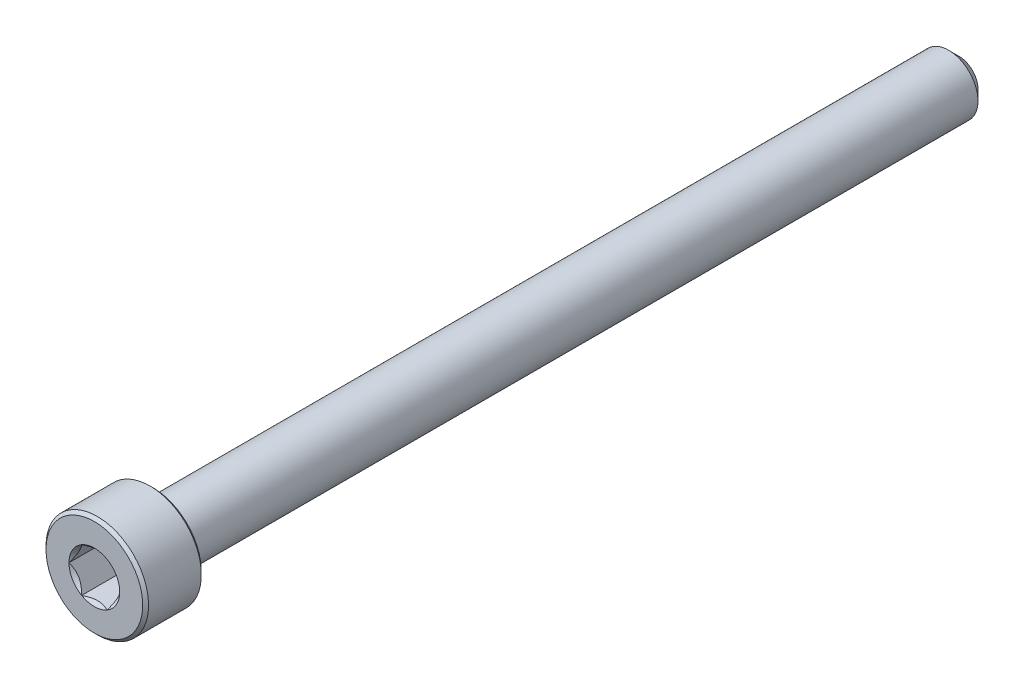
from build123d import *

# Parameters (mm, degrees)
CUT_EXTRUDE1_DEPTH = 3


with BuildPart() as part:
    # Sketch2 → Revolve1 (revolve)
    with BuildSketch(Plane(origin=(0, 0, 0), x_dir=(0, 0, -1), z_dir=(1, 0, 0)), mode=Mode.PRIVATE) as revolve1_sk:
        Polygon((-29.5, 0), (-29.5, 3.3), (-29.3, 3.5), (-25.7, 3.5), (-25.5, 3.3), (-25.5, 2), (28.8, 2), (29.5, 1.3), (29.5, 0), align=None)
    revolve(revolve1_sk.sketch.rotate(Axis((0, 0, -29.5), (0, 0, 1)), 90), axis=Axis((0, 0, -29.5), (0, 0, 1)))

    # Sketch3 → Cut-Extrude1 (cut)
    with BuildSketch(Plane.XY.offset(29.5)):
        Polygon((0.866025404, 1.5), (-0.866025404, 1.5), (-1.732050808, 0), (-0.866025404, -1.5), (0.866025404, -1.5), (1.732050808, 0), align=None)
    extrude(amount=-CUT_EXTRUDE1_DEPTH, mode=Mode.SUBTRACT)

    # Cut-Extrude2 cone 1 section (through the dimple's axis) → Cut-Extrude2 (revolve, cut)
    with BuildSketch(Plane(origin=(0, 0, 29.5), x_dir=(0, -1, 0), z_dir=(1, 0, 0))):
        Polygon((0, 0), (1.732050808, 0), (0, 1.732050808), align=None)
    revolve(axis=Axis((0, 0, 29.5), (0, 0, -1)), mode=Mode.SUBTRACT)


solid = part.part
